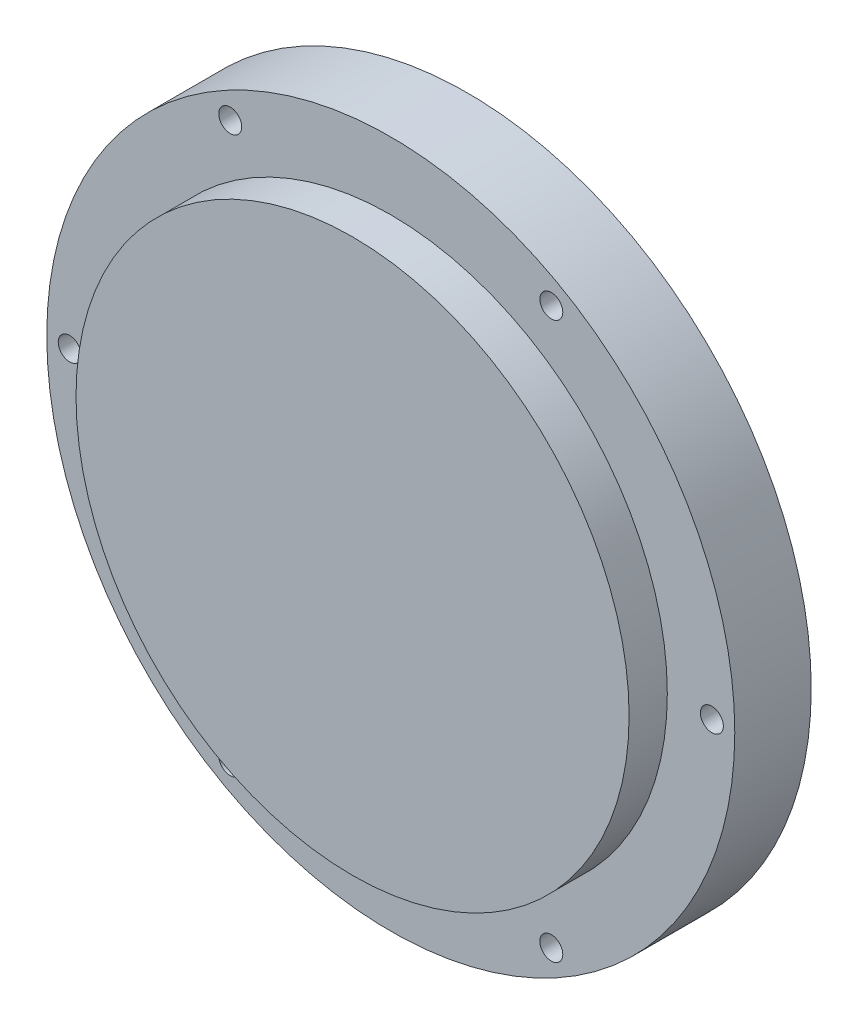
from build123d import *

# Parameters (mm, degrees)
SKETCH1_R           = 45
BOSS_EXTRUDE1_DEPTH = 5
SKETCH2_R           = 36.175
BOSS_EXTRUDE2_DEPTH = 5
SKETCH4_R           = 1.5
CUT_EXTRUDE2_DEPTH  = 66.383484153


with BuildPart() as part:
    # Sketch1 → Boss-Extrude1 (new, symmetric)
    with BuildSketch(Plane.XY):
        Circle(SKETCH1_R)
    extrude(amount=BOSS_EXTRUDE1_DEPTH, both=True)

    # Sketch2 → Boss-Extrude2 (add, symmetric)
    with BuildSketch(Plane.XY.offset(5)):
        Circle(SKETCH2_R)
    extrude(amount=BOSS_EXTRUDE2_DEPTH, both=True)

    # Sketch4 → Cut-Extrude2 (cut, through all)
    with BuildSketch(Plane(origin=(0, 0, -5), x_dir=(-1, 0, 0), z_dir=(0, 0, -1))):
        with Locations((-42, 0)):
            Circle(SKETCH4_R)
        with Locations((-21, 36.373066959)):
            Circle(SKETCH4_R)
        with Locations((21, 36.373066959)):
            Circle(SKETCH4_R)
        with Locations((42, 0)):
            Circle(SKETCH4_R)
        with Locations((21, -36.373066959)):
            Circle(SKETCH4_R)
        with Locations((-21, -36.373066959)):
            Circle(SKETCH4_R)
    extrude(amount=-CUT_EXTRUDE2_DEPTH, mode=Mode.SUBTRACT)


solid = part.part
